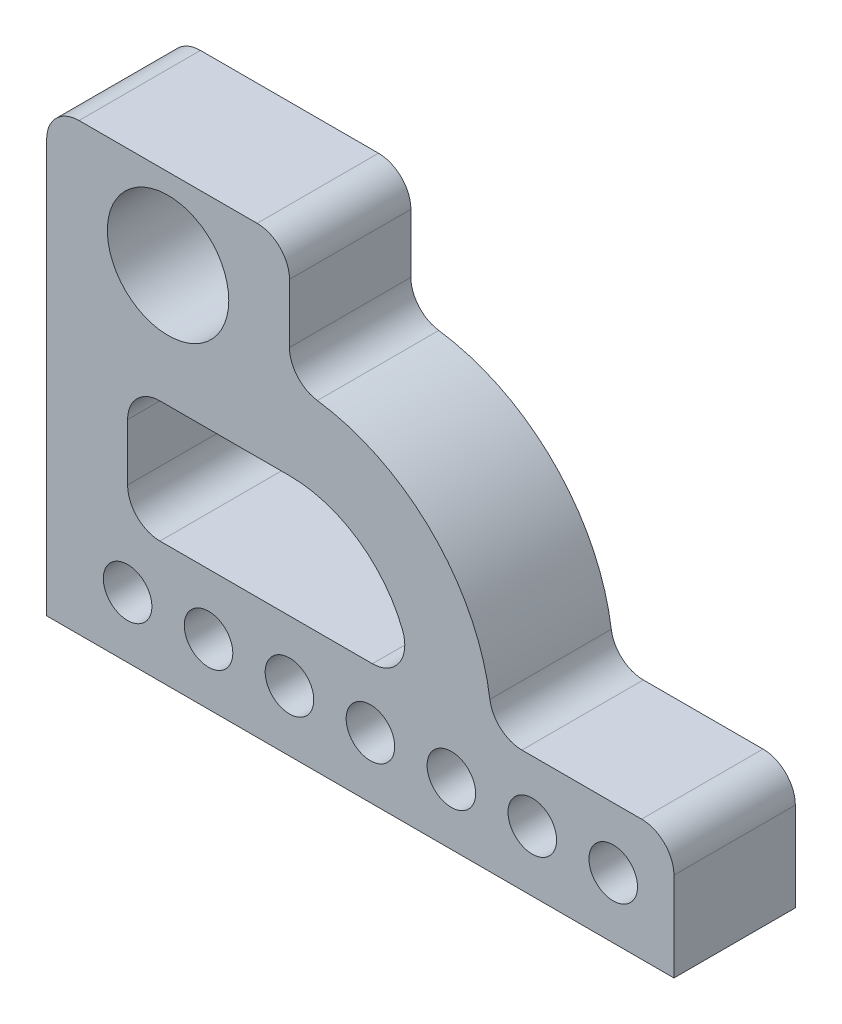
from build123d import *

# Parameters (mm, degrees)
SKETCH2_R           = 6
SKETCH2_R_2         = 15
BOSS_EXTRUDE1_DEPTH = 30


with BuildPart() as part:
    # Sketch2 → Boss-Extrude1 (new body)
    with BuildSketch(Plane.XY):
        with BuildLine():
            Line((-90.841121495, 71.557977192), (-90.841121495, -30.442022808))
            Line((-90.841121495, -30.442022808), (64.158878505, -30.442022808))
            Line((64.158878505, -30.442022808), (64.158878505, -8.442022808))
            ThreePointArc((64.158878505, -8.442022808), (61.815732754, -2.785168558), (56.158878505, -0.442022808))
            Line((56.158878505, -0.442022808), (26.60450497, -0.442022808))
            ThreePointArc((26.60450497, -0.442022808), (21.352247656, 1.523592956), (18.680970285, 6.454528916))
            ThreePointArc((18.680970285, 6.454528916), (4.514217564, 34.913316251), (-23.944569771, 49.080068973))
            ThreePointArc((-23.944569771, 49.080068973), (-28.875505731, 51.751346343), (-30.841121495, 57.003603657))
            Line((-30.841121495, 57.003603657), (-30.841121495, 71.557977192))
            ThreePointArc((-30.841121495, 71.557977192), (-33.184267246, 77.214831442), (-38.841121495, 79.557977192))
            Line((-38.841121495, 79.557977192), (-82.841121495, 79.557977192))
            ThreePointArc((-82.841121495, 79.557977192), (-88.497975745, 77.214831442), (-90.841121495, 71.557977192))
        make_face()
        with Locations((-70.841121495, -15.442022808)):
            Circle(SKETCH2_R, mode=Mode.SUBTRACT)
        with Locations((-50.841121495, -15.442022808)):
            Circle(SKETCH2_R, mode=Mode.SUBTRACT)
        with Locations((-30.841121495, -15.442022808)):
            Circle(SKETCH2_R, mode=Mode.SUBTRACT)
        with Locations((-10.841121495, -15.442022808)):
            Circle(SKETCH2_R, mode=Mode.SUBTRACT)
        with Locations((9.158878505, -15.442022808)):
            Circle(SKETCH2_R, mode=Mode.SUBTRACT)
        with Locations((29.158878505, -15.442022808)):
            Circle(SKETCH2_R, mode=Mode.SUBTRACT)
        with Locations((49.158878505, -15.442022808)):
            Circle(SKETCH2_R, mode=Mode.SUBTRACT)
        with Locations((-60.841121495, 59.557977192)):
            Circle(SKETCH2_R_2, mode=Mode.SUBTRACT)
        with BuildLine():
            Line((-62.841121495, -0.442022808), (-10.347219963, -0.442022808))
            ThreePointArc((-10.347219963, -0.442022808), (-3.741437373, 3.045368594), (-2.894892134, 10.467068101))
            ThreePointArc((-2.894892134, 10.467068101), (-13.918839251, 24.329661907), (-30.841121495, 29.557977192))
            Line((-30.841121495, 29.557977192), (-62.841121495, 29.557977192))
            ThreePointArc((-62.841121495, 29.557977192), (-68.497975745, 27.214831442), (-70.841121495, 21.557977192))
            Line((-70.841121495, 21.557977192), (-70.841121495, 7.557977192))
            ThreePointArc((-70.841121495, 7.557977192), (-68.497975745, 1.901122943), (-62.841121495, -0.442022808))
        make_face(mode=Mode.SUBTRACT)
    extrude(amount=BOSS_EXTRUDE1_DEPTH)


solid = part.part
